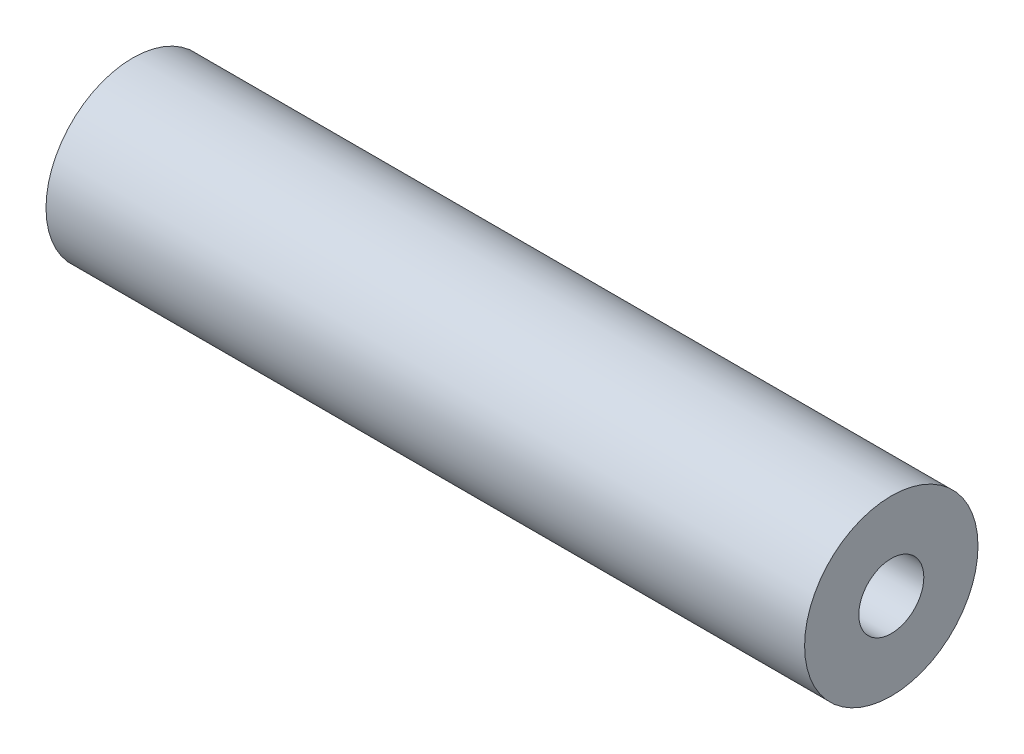
from build123d import *

# Parameters (mm, degrees)
SKETCH_1_R      = 4
SKETCH_1_R_2    = 1.5
EXTRUDE_1_DEPTH = 35


with BuildPart() as part:
    # ｽｹｯﾁ1 → ﾎﾞｽ - 押し出し1 (new body)
    with BuildSketch(Plane(origin=(0, 0, 0), x_dir=(0, 0, -1), z_dir=(1, 0, 0))):
        Circle(SKETCH_1_R)
        Circle(SKETCH_1_R_2, mode=Mode.SUBTRACT)
    extrude(amount=EXTRUDE_1_DEPTH)


solid = part.part
